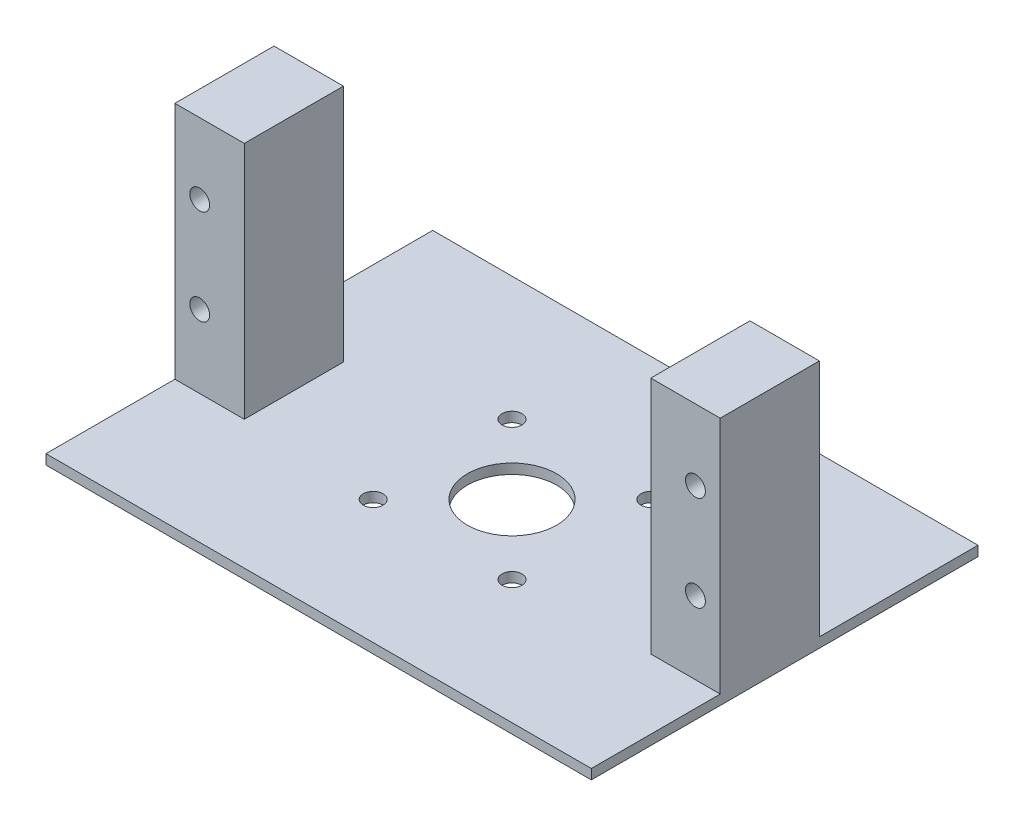
from build123d import *

# Parameters (mm, degrees)
SKETCH1_W           = 55
SKETCH1_H           = 39
BOSS_EXTRUDE1_DEPTH = 1
CUT_EXTRUDE1_REACH  = 69.431
SKETCH3_R           = 1
SKETCH3_R_2         = 4.5
SKETCH2_W           = 7
SKETCH2_H           = 10
BOSS_EXTRUDE2_DEPTH = 24.1
CUT_EXTRUDE2_REACH  = 67.81
SKETCH4_R           = 1


with BuildPart() as part:
    # Sketch1 → Boss-Extrude1 (new body)
    with BuildSketch(Plane(origin=(0, 0, 0), x_dir=(1, 0, 0), z_dir=(0, 1, 0))):
        with Locations((27.5, 19.5)):
            Rectangle(SKETCH1_W, SKETCH1_H)
    extrude(amount=BOSS_EXTRUDE1_DEPTH)

    # Sketch3 → Cut-Extrude1 (cut, up to next)
    with BuildSketch(Plane(origin=(0, 1, 0), x_dir=(1, 0, 0), z_dir=(0, 1, 0)), mode=Mode.PRIVATE) as cut_extrude1_sk1:
        with Locations(Location((34.5, 26.5, 0), (0, 0, 270))):
            Circle(SKETCH3_R)
    cut_extrude1_tool1 = extrude(cut_extrude1_sk1.sketch, amount=-CUT_EXTRUDE1_REACH, mode=Mode.PRIVATE) & part.part
    # Sketch3 → Cut-Extrude1 (cut, up to next)
    with BuildSketch(Plane(origin=(0, 1, 0), x_dir=(1, 0, 0), z_dir=(0, 1, 0)), mode=Mode.PRIVATE) as cut_extrude1_sk2:
        with Locations(Location((34.5, 12.5, 0), (0, 0, 270))):
            Circle(SKETCH3_R)
    cut_extrude1_tool2 = extrude(cut_extrude1_sk2.sketch, amount=-CUT_EXTRUDE1_REACH, mode=Mode.PRIVATE) & part.part
    # Sketch3 → Cut-Extrude1 (cut, up to next)
    with BuildSketch(Plane(origin=(0, 1, 0), x_dir=(1, 0, 0), z_dir=(0, 1, 0)), mode=Mode.PRIVATE) as cut_extrude1_sk3:
        with Locations(Location((20.5, 12.5, 0), (0, 0, 270))):
            Circle(SKETCH3_R)
    cut_extrude1_tool3 = extrude(cut_extrude1_sk3.sketch, amount=-CUT_EXTRUDE1_REACH, mode=Mode.PRIVATE) & part.part
    # Sketch3 → Cut-Extrude1 (cut, up to next)
    with BuildSketch(Plane(origin=(0, 1, 0), x_dir=(1, 0, 0), z_dir=(0, 1, 0)), mode=Mode.PRIVATE) as cut_extrude1_sk4:
        with Locations(Location((20.5, 26.5, 0), (0, 0, 270))):
            Circle(SKETCH3_R)
    cut_extrude1_tool4 = extrude(cut_extrude1_sk4.sketch, amount=-CUT_EXTRUDE1_REACH, mode=Mode.PRIVATE) & part.part
    # Sketch3 → Cut-Extrude1 (cut, up to next)
    with BuildSketch(Plane(origin=(0, 1, 0), x_dir=(1, 0, 0), z_dir=(0, 1, 0)), mode=Mode.PRIVATE) as cut_extrude1_sk5:
        with Locations(Location((27.5, 19.5, 0), (0, 0, 270))):
            Circle(SKETCH3_R_2)
    cut_extrude1_tool5 = extrude(cut_extrude1_sk5.sketch, amount=-CUT_EXTRUDE1_REACH, mode=Mode.PRIVATE) & part.part
    add(cut_extrude1_tool1.solids().sort_by_distance((34.5, 1, -26.5))[0], mode=Mode.SUBTRACT)
    add(cut_extrude1_tool2.solids().sort_by_distance((34.5, 1, -12.5))[0], mode=Mode.SUBTRACT)
    add(cut_extrude1_tool3.solids().sort_by_distance((20.5, 1, -12.5))[0], mode=Mode.SUBTRACT)
    add(cut_extrude1_tool4.solids().sort_by_distance((20.5, 1, -26.5))[0], mode=Mode.SUBTRACT)
    add(cut_extrude1_tool5.solids().sort_by_distance((27.5, 1, -19.5))[0], mode=Mode.SUBTRACT)

    # Sketch2 → Boss-Extrude2 (add)
    with BuildSketch(Plane(origin=(0, 1, 0), x_dir=(1, 0, 0), z_dir=(0, 1, 0))):
        with Locations((51.5, 18)):
            Rectangle(SKETCH2_W, SKETCH2_H)
        with Locations((3.5, 18)):
            Rectangle(SKETCH2_W, SKETCH2_H)
    extrude(amount=BOSS_EXTRUDE2_DEPTH)

    # Sketch4 → Cut-Extrude2 (cut, up to next)
    with BuildSketch(Plane.XY.offset(-13), mode=Mode.PRIVATE) as cut_extrude2_sk1:
        with Locations((2.5, 17.95)):
            Circle(SKETCH4_R)
    cut_extrude2_tool1 = extrude(cut_extrude2_sk1.sketch, amount=-CUT_EXTRUDE2_REACH, mode=Mode.PRIVATE) & part.part
    # Sketch4 → Cut-Extrude2 (cut, up to next)
    with BuildSketch(Plane.XY.offset(-13), mode=Mode.PRIVATE) as cut_extrude2_sk2:
        with Locations((2.5, 8.35)):
            Circle(SKETCH4_R)
    cut_extrude2_tool2 = extrude(cut_extrude2_sk2.sketch, amount=-CUT_EXTRUDE2_REACH, mode=Mode.PRIVATE) & part.part
    # Sketch4 → Cut-Extrude2 (cut, up to next)
    with BuildSketch(Plane.XY.offset(-13), mode=Mode.PRIVATE) as cut_extrude2_sk3:
        with Locations((52.5, 8.35)):
            Circle(SKETCH4_R)
    cut_extrude2_tool3 = extrude(cut_extrude2_sk3.sketch, amount=-CUT_EXTRUDE2_REACH, mode=Mode.PRIVATE) & part.part
    # Sketch4 → Cut-Extrude2 (cut, up to next)
    with BuildSketch(Plane.XY.offset(-13), mode=Mode.PRIVATE) as cut_extrude2_sk4:
        with Locations((52.5, 17.95)):
            Circle(SKETCH4_R)
    cut_extrude2_tool4 = extrude(cut_extrude2_sk4.sketch, amount=-CUT_EXTRUDE2_REACH, mode=Mode.PRIVATE) & part.part
    add(cut_extrude2_tool1.solids().sort_by_distance((2.5, 17.95, -13))[0], mode=Mode.SUBTRACT)
    add(cut_extrude2_tool2.solids().sort_by_distance((2.5, 8.35, -13))[0], mode=Mode.SUBTRACT)
    add(cut_extrude2_tool3.solids().sort_by_distance((52.5, 8.35, -13))[0], mode=Mode.SUBTRACT)
    add(cut_extrude2_tool4.solids().sort_by_distance((52.5, 17.95, -13))[0], mode=Mode.SUBTRACT)


solid = part.part
